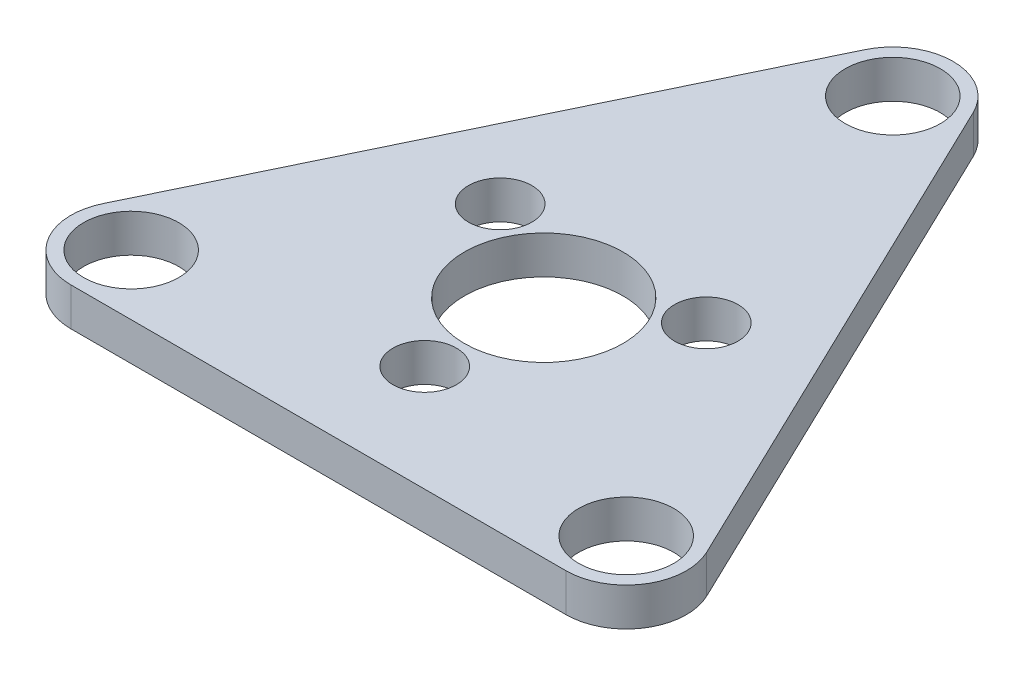
from build123d import *

# Parameters (mm, degrees)
SKETCH1_R           = 15
SKETCH1_R_2         = 25
BOSS_EXTRUDE1_DEPTH = 6
HOLE1_D             = 20
CIRPATTERN1_COUNT   = 3


with BuildPart() as part:
    # Sketch1 → Boss-Extrude1 (new, symmetric)
    with BuildSketch(Plane(origin=(0, 0, 0), x_dir=(1, 0, 0), z_dir=(0, 1, 0))):
        with BuildLine():
            Line((-95.119031725, -43.757503243), (-17.119031725, 118.242496757))
            ThreePointArc((-17.119031725, 118.242496757), (0, 129), (17.119031725, 118.242496757))
            Line((17.119031725, 118.242496757), (95.119031725, -43.757503243))
            ThreePointArc((95.119031725, -43.757503243), (94.087377636, -62.109217616), (78, -71))
            Line((78, -71), (-78, -71))
            ThreePointArc((-78, -71), (-94.087377636, -62.109217616), (-95.119031725, -43.757503243))
        make_face()
        with Locations(Location((0, 110, 0), (0, 0, 270))):
            Circle(SKETCH1_R, mode=Mode.SUBTRACT)
        with Locations(Location((-78, -52, 0), (0, 0, 270))):
            Circle(SKETCH1_R, mode=Mode.SUBTRACT)
        with Locations(Location((78, -52, 0), (0, 0, 270))):
            Circle(SKETCH1_R, mode=Mode.SUBTRACT)
        with Locations(Location((0, 0, 0), (0, 0, 270))):
            Circle(SKETCH1_R_2, mode=Mode.SUBTRACT)
    extrude(amount=BOSS_EXTRUDE1_DEPTH, both=True)

    # Hole1 (through all)
    with Locations(Plane(origin=(0, 6, 0), x_dir=(1, 0, 0), z_dir=(0, 1, 0))):
        with Locations((0, -37.5)):
            hole1 = Hole(HOLE1_D / 2)

    # CirPattern1: Hole1 ×3 about axis
    cirpattern1_axis = Axis((0, 0, 0), (0, 1, 0))
    for i in range(1, CIRPATTERN1_COUNT):
        add(hole1.rotate(cirpattern1_axis, i * 360 / CIRPATTERN1_COUNT), mode=Mode.SUBTRACT)


solid = part.part
